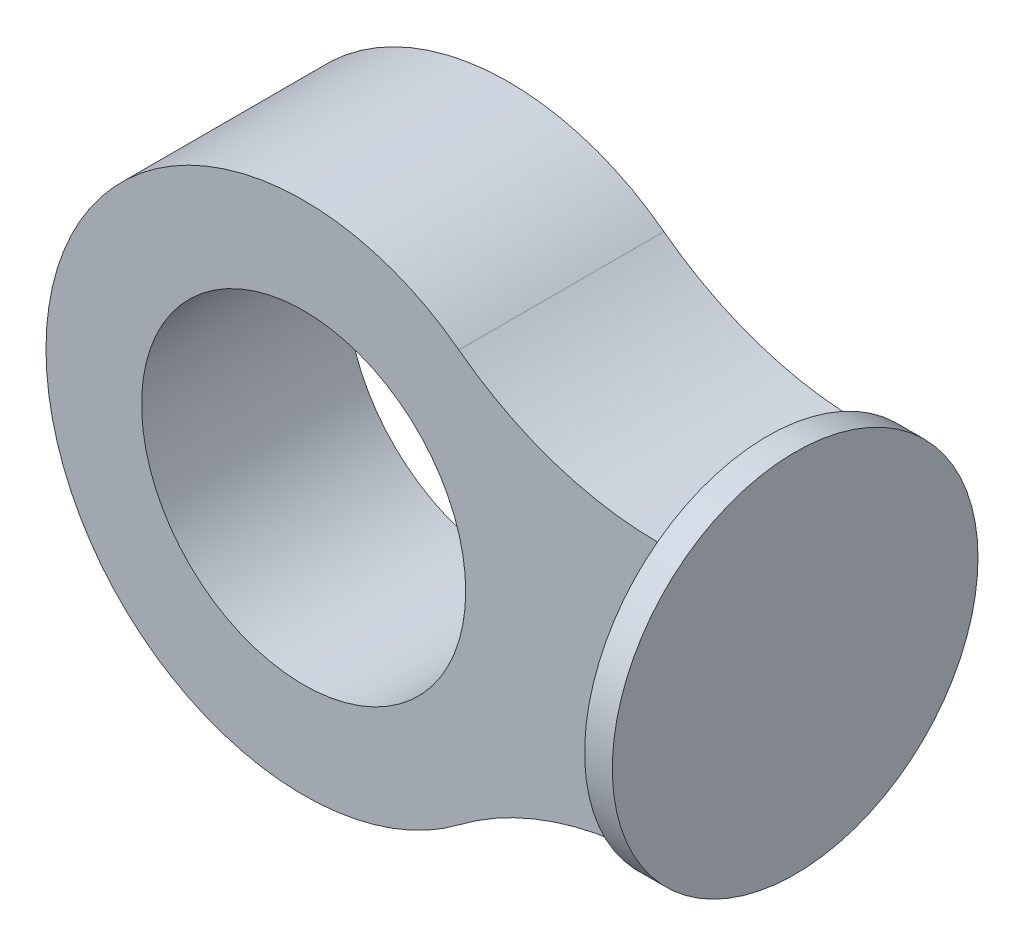
from build123d import *

# Parameters (mm, degrees)
SKETCH1_R           = 29.25
BOSS_EXTRUDE1_DEPTH = 37
SKETCH2_R           = 33
BOSS_EXTRUDE2_DEPTH = 5


with BuildPart() as part:
    # Sketch1 → Boss-Extrude1 (new body)
    with BuildSketch(Plane.XY):
        with BuildLine():
            Line((64.16580086, 25), (65.20777984, 25))
            Line((65.20777984, 25), (65.20777984, -25))
            Line((65.20777984, -25), (64.16580086, -25))
            ThreePointArc((64.16580086, -25), (45.103264783, -28.108702614), (28.016053897, -37.112676056))
            ThreePointArc((28.016053897, -37.112676056), (-46.5, 0), (28.016053897, 37.112676056))
            ThreePointArc((28.016053897, 37.112676056), (45.103264783, 28.108702614), (64.16580086, 25))
        make_face()
        Circle(SKETCH1_R, mode=Mode.SUBTRACT)
    extrude(amount=BOSS_EXTRUDE1_DEPTH)

    # Sketch2 → Boss-Extrude2 (add)
    with BuildSketch(Plane(origin=(65.20777984, 0, 0), x_dir=(0, 0, -1), z_dir=(1, 0, 0))):
        with Locations((-18.5, 0)):
            Circle(SKETCH2_R)
    extrude(amount=BOSS_EXTRUDE2_DEPTH)


solid = part.part
